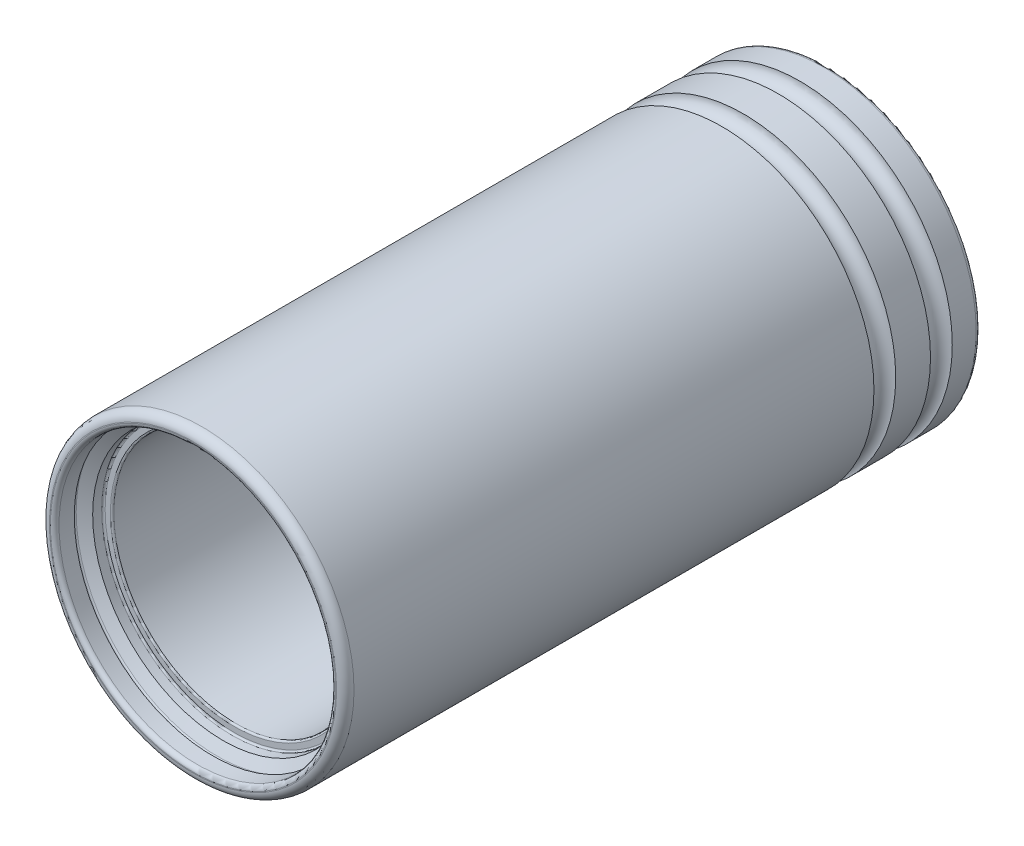
from build123d import *

# Parameters (mm, degrees)
SKETCH_1_R          = 17.5
EXTRUDE_1_DEPTH     = 73
FILLET_1_R          = 0.2
FILLET_2_R          = 1
CUT_EXTRUDE_START   = -2.6
SKETCH_6_R          = 15.9
SKETCH_6_R_2        = 14
CUT_EXTRUDE_1_DEPTH = 2.6
FILLET_3_R          = 0.5
FILLET_4_R          = 0.1
FILLET_5_R          = 0.2
FILLET_6_R          = 0.4
FILLET_7_R          = 0.2
SKETCH_8_R          = 1.25
FILLET_10_R         = 0.2
FILLET_11_R         = 0.5


with BuildPart() as part:
    # Эскиз1 → Бобышка-Вытянуть1 (new body)
    with BuildSketch(Plane.XY):
        Circle(SKETCH_1_R)
    extrude(amount=-EXTRUDE_1_DEPTH)

    # Эскиз4 → Вырез-Повернуть1 (revolve, cut)
    with BuildSketch(Plane(origin=(0, 0, 0), x_dir=(0, 0, -1), z_dir=(1, 0, 0)), mode=Mode.PRIVATE) as cut_revolve_1_sk:
        with BuildLine():
            Line((0, 0), (0, 15))
            Line((0, 15), (4.7, 15))
            Line((4.7, 15), (4.7, 14))
            Line((4.7, 14), (23.3, 14))
            Line((23.3, 14), (23.3, 11))
            Line((23.3, 11), (29.100069642, 9.5))
            Line((29.100069642, 9.5), (30.8, 9.5))
            Line((30.8, 9.5), (30.8, 10.1))
            Line((30.8, 10.1), (32, 10.1))
            Line((32, 10.1), (32.346410162, 9.5))
            Line((32.346410162, 9.5), (46, 9.5))
            Line((46, 9.5), (46, 7.5))
            Line((46, 7.5), (46.523593261, 5.5))
            Line((46.523593261, 5.5), (50, 5.5))
            Line((50, 5.5), (50, 9.5))
            Line((50, 9.5), (53.8, 9.5))
            ThreePointArc((53.8, 9.5), (54.4, 10.1), (55, 9.5))
            Line((55, 9.5), (56.5, 9.5))
            Line((56.5, 9.5), (56.5, 10.75))
            Line((56.5, 10.75), (68, 10.75))
            Line((68, 10.75), (68, 12.4))
            Line((68, 12.4), (71, 12.4))
            Line((71, 12.4), (71, 10.75))
            Line((71, 10.75), (73, 10.75))
            Line((73, 10.75), (73, 0))
            Line((73, 0), (0, 0))
        make_face()
    revolve(cut_revolve_1_sk.sketch.rotate(Axis((0, 0, -73), (0, 0, 1)), 90), axis=Axis((0, 0, -73), (0, 0, 1)), mode=Mode.SUBTRACT)

    # Эскиз5 → Вырез-Повернуть2 (revolve, cut)
    with BuildSketch(Plane(origin=(0, 0, 0), x_dir=(0, 0, -1), z_dir=(1, 0, 0)), mode=Mode.PRIVATE) as cut_revolve_2_sk:
        Polygon((3.466025404, 15), (1.733974596, 15), (2.6, 16.5), align=None)
    revolve(cut_revolve_2_sk.sketch.rotate(Axis((0, 0, 0), (0, 0, -1)), 270), axis=Axis((0, 0, 0), (0, 0, -1)), mode=Mode.SUBTRACT)

    # Скругление1
    fillet_1_edges = [part.edges().sort_by_distance(p)[0] for p in [
        (16.5, 0, -2.6),
        (15, 0, -4.7),
    ]]
    fillet(fillet_1_edges, radius=FILLET_1_R)

    # Скругление2
    fillet_2_edges = [part.edges().sort_by_distance(p)[0] for p in [
        (-17.5, 0, 0),
        (14, 0, -23.3),
    ]]
    fillet(fillet_2_edges, radius=FILLET_2_R)

    # Эскиз6 → Вырез-Вытянуть1 (cut)
    with BuildSketch(Plane.XY.offset(CUT_EXTRUDE_START)):
        Circle(SKETCH_6_R)
        with Locations(Location((0, 0, 0), (0, 0, 180))):
            Circle(SKETCH_6_R_2, mode=Mode.SUBTRACT)
    extrude(amount=CUT_EXTRUDE_1_DEPTH, mode=Mode.SUBTRACT)

    # Скругление3
    fillet_3_edges = [part.edges().sort_by_distance(p)[0] for p in [
        (-17.5, 0, -73),
        (11, 0, -23.3),
        (9.5, 0, -29.100069642),
        (5.5, 0, -46.523593261),
        (5.5, 0, -50),
        (10.75, 0, -73),
    ]]
    fillet(fillet_3_edges, radius=FILLET_3_R)

    # Скругление4
    fillet_4_edges = [part.edges().sort_by_distance(p)[0] for p in [
        (10.1, 0, -30.8),
        (10.1, 0, -32),
    ]]
    fillet(fillet_4_edges, radius=FILLET_4_R)

    # Скругление5
    fillet_5_edges = [part.edges().sort_by_distance(p)[0] for p in [
        (9.5, 0, -30.8),
        (9.5, 0, -32.346410162),
        (10.75, 0, -68),
        (10.75, 0, -71),
    ]]
    fillet(fillet_5_edges, radius=FILLET_5_R)

    # Скругление6
    fillet_6_edges = [part.edges().sort_by_distance(p)[0] for p in [
        (12.4, 0, -68),
        (12.4, 0, -71),
    ]]
    fillet(fillet_6_edges, radius=FILLET_6_R)

    # Скругление7
    fillet_7_edges = [part.edges().sort_by_distance(p)[0] for p in [
        (14, 0, -4.7),
        (9.5, 0, -56.5),
        (10.75, 0, -56.5),
    ]]
    fillet(fillet_7_edges, radius=FILLET_7_R)

    # Эскиз7 → Повернуть1 (revolve)
    with BuildSketch(Plane(origin=(0, 0, 0), x_dir=(1, 0, 0), z_dir=(0, 1, 0)), mode=Mode.PRIVATE) as revolve_1_sk:
        with BuildLine():
            Line((-15.75, 73), (-13.25, 73))
            ThreePointArc((-13.25, 73), (-14.5, 74.25), (-15.75, 73))
        make_face()
    revolve(revolve_1_sk.sketch.rotate(Axis((0, 0, -88.958875933), (0, 0, 1)), 180), axis=Axis((0, 0, -88.958875933), (0, 0, 1)))

    # Эскиз8 → Вырез-Повернуть3 (revolve, cut)
    with BuildSketch(Plane(origin=(0, 0, 0), x_dir=(0, 0, -1), z_dir=(1, 0, 0)), mode=Mode.PRIVATE) as cut_revolve_3_sk:
        with Locations((68.5, 17.5)):
            Circle(SKETCH_8_R)
        with Locations((62, 17.5)):
            Circle(SKETCH_8_R)
    revolve(cut_revolve_3_sk.sketch.rotate(Axis((0, 0, 0), (0, 0, -1)), 90), axis=Axis((0, 0, 0), (0, 0, -1)), mode=Mode.SUBTRACT)

    # Скругление10
    fillet_10_edges = [part.edges().sort_by_distance(p)[0] for p in [
        (9.5, 0, -50),
    ]]
    fillet(fillet_10_edges, radius=FILLET_10_R)

    # Скругление11
    fillet_11_edges = [part.edges().sort_by_distance(p)[0] for p in [
        (-15.9, 0, 0),
    ]]
    fillet(fillet_11_edges, radius=FILLET_11_R)


solid = part.part
